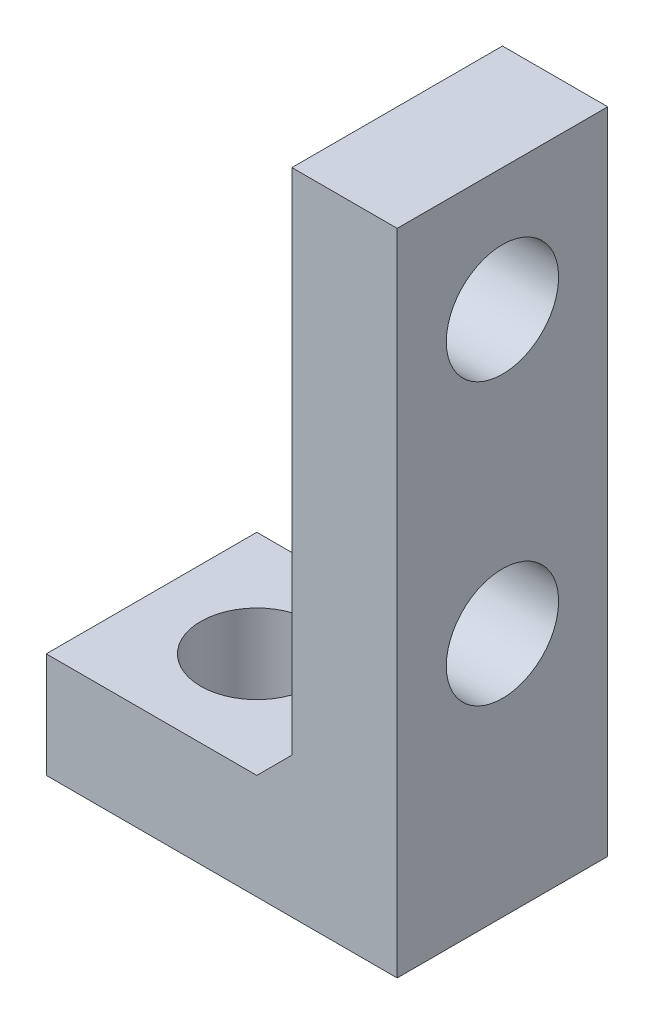
from build123d import *

# Parameters (mm, degrees)
SKETCH1_W           = 10
SKETCH1_H           = 6
SKETCH1_R           = 1.6
BOSS_EXTRUDE1_DEPTH = 3
SKETCH2_W           = 3
SKETCH2_H           = 6
BOSS_EXTRUDE2_DEPTH = 15.5
SKETCH3_R           = 1.6
CUT_EXTRUDE1_DEPTH  = 21.006249024
BOSS_EXTRUDE3_DEPTH = 6


with BuildPart() as part:
    # Sketch1 → Boss-Extrude1 (new body)
    with BuildSketch(Plane(origin=(0, 0, 0), x_dir=(1, 0, 0), z_dir=(0, 1, 0))):
        Rectangle(SKETCH1_W, SKETCH1_H)
        with Locations(Location((-2, 0, 0), (0, 0, 270))):
            Circle(SKETCH1_R, mode=Mode.SUBTRACT)
    extrude(amount=BOSS_EXTRUDE1_DEPTH)

    # Sketch2 → Boss-Extrude2 (add)
    with BuildSketch(Plane(origin=(0, 3, 0), x_dir=(1, 0, 0), z_dir=(0, 1, 0))):
        with Locations((3.5, 0)):
            Rectangle(SKETCH2_W, SKETCH2_H)
    extrude(amount=BOSS_EXTRUDE2_DEPTH)

    # Sketch3 → Cut-Extrude1 (cut, through all)
    with BuildSketch(Plane.ZY.offset(-2)):
        with Locations((0, 7)):
            Circle(SKETCH3_R)
        with Locations((0, 15)):
            Circle(SKETCH3_R)
    extrude(amount=-CUT_EXTRUDE1_DEPTH, mode=Mode.SUBTRACT)

    # Sketch5 → Boss-Extrude3 (add)
    with BuildSketch(Plane(origin=(2, 3, 3), x_dir=(1, 0, 0), z_dir=(0, 0, 1))):
        Polygon((-1, 0), (0, 1), (0, 0), align=None)
    extrude(amount=-BOSS_EXTRUDE3_DEPTH)


solid = part.part
